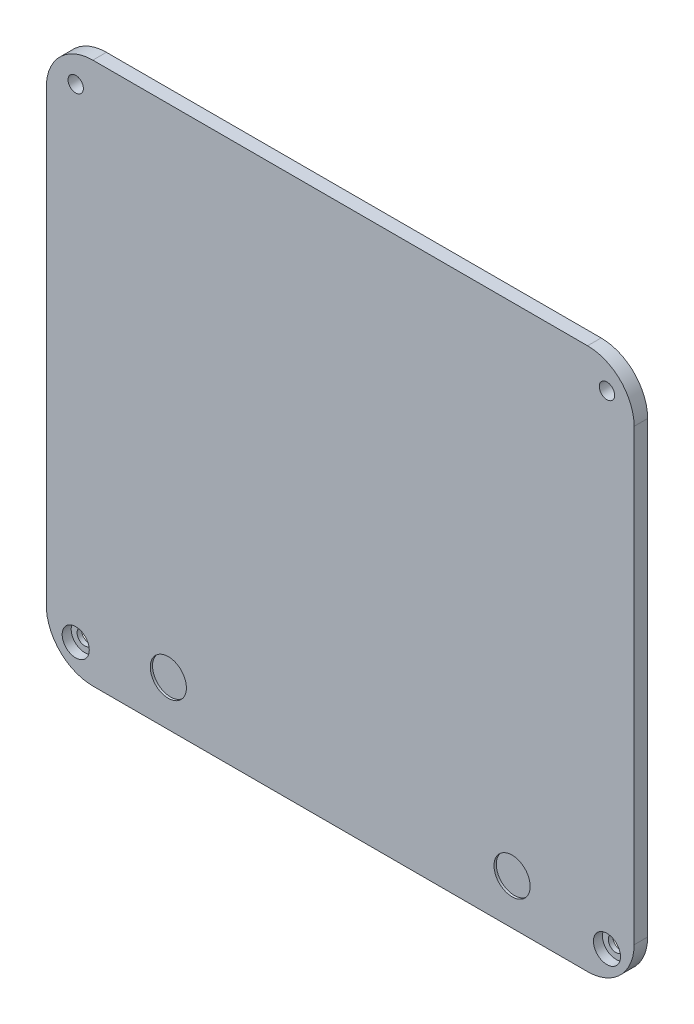
from build123d import *

# Parameters (mm, degrees)
SKIZZE1_R                       = 1.7
AUFSATZ_LINEAR_AUSTRAGEN1_DEPTH = 3
SKIZZE2_R                       = 3
SCHNITT_LINEAR_AUSTRAGEN1_DEPTH = 2
SKIZZE3_R                       = 4
SCHNITT_LINEAR_AUSTRAGEN2_DEPTH = 0.5


with BuildPart() as part:
    # Skizze1 → Aufsatz-Linear austragen1 (new body)
    with BuildSketch(Plane.XY):
        with BuildLine():
            Line((-49.2275, -151.2967), (-49.2275, -51.8905))
            ThreePointArc((-49.2275, -51.8905), (-52.244300154, -44.607300154), (-59.5275, -41.5905))
            Line((-59.5275, -41.5905), (-169.0581, -41.5905))
            ThreePointArc((-169.0581, -41.5905), (-176.514207067, -44.783915623), (-179.34742314, -52.3842))
            Line((-179.34742314, -52.3842), (-179.34742314, -150.803560266))
            ThreePointArc((-179.34742314, -150.803560266), (-176.514004305, -158.403485592), (-169.0581, -161.5967))
            Line((-169.0581, -161.5967), (-59.5275, -161.5967))
            ThreePointArc((-59.5275, -161.5967), (-52.244300154, -158.579899846), (-49.2275, -151.2967))
        make_face()
        with Locations((-172.84742314, -155.0967)):
            Circle(SKIZZE1_R, mode=Mode.SUBTRACT)
        with Locations((-55.2338, -155.0967)):
            Circle(SKIZZE1_R, mode=Mode.SUBTRACT)
        with Locations((-55.2338, -48.0905)):
            Circle(SKIZZE1_R, mode=Mode.SUBTRACT)
        with Locations((-172.84742314, -48.0905)):
            Circle(SKIZZE1_R, mode=Mode.SUBTRACT)
    extrude(amount=AUFSATZ_LINEAR_AUSTRAGEN1_DEPTH)

    # Skizze2 → Schnitt-Linear austragen1 (cut)
    with BuildSketch(Plane.XY.offset(3)):
        with Locations((-172.84742314, -155.0967)):
            Circle(SKIZZE2_R)
        with Locations((-55.2338, -155.0967)):
            Circle(SKIZZE2_R)
    extrude(amount=-SCHNITT_LINEAR_AUSTRAGEN1_DEPTH, mode=Mode.SUBTRACT)

    # Skizze3 → Schnitt-Linear austragen2 (cut)
    with BuildSketch(Plane.XY.offset(3)):
        with Locations((-152.34742314, -151.5967)):
            Circle(SKIZZE3_R)
        with Locations(Location((-76.23817686, -151.5967, 0), (0, 0, 180))):
            Circle(SKIZZE3_R)
    extrude(amount=-SCHNITT_LINEAR_AUSTRAGEN2_DEPTH, mode=Mode.SUBTRACT)


solid = part.part
